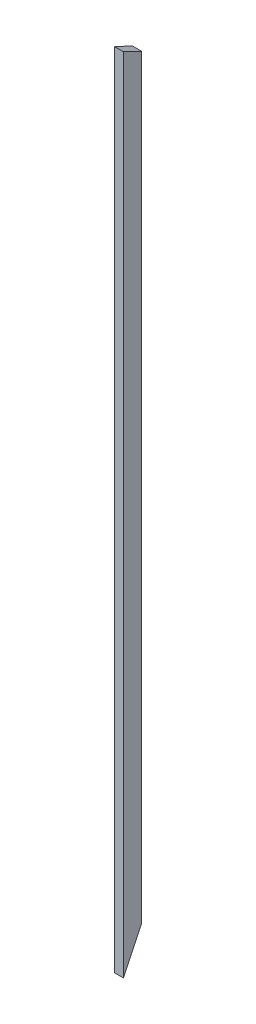
from build123d import *

# Parameters (mm, degrees)
SKETCH_1_W          = 25
SKETCH_1_H          = 50
EXTRUDE_1_DEPTH     = 2214.15898255
CUT_EXTRUDE_2_DEPTH = 50
CUT_EXTRUDE_3_DEPTH = 50


with BuildPart() as part:
    # Эскиз1 → Бобышка-Вытянуть1 (new body)
    with BuildSketch(Plane(origin=(0, 0, 0), x_dir=(1, 0, 0), z_dir=(0, 1, 0))):
        Rectangle(SKETCH_1_W, SKETCH_1_H)
    extrude(amount=EXTRUDE_1_DEPTH)

    # Эскиз3 → Вырез-Вытянуть2 (cut)
    with BuildSketch(Plane.ZY.offset(12.5)):
        Polygon((25, 0), (-25, 105.257973095), (-25, 0), align=None)
    extrude(amount=-CUT_EXTRUDE_2_DEPTH, mode=Mode.SUBTRACT)

    # Эскиз4 → Вырез-Вытянуть3 (cut)
    with BuildSketch(Plane.ZY.offset(12.5)):
        Polygon((25, 2214.15898255), (-25, 2190.418247515), (-25, 2214.15898255), align=None)
    extrude(amount=-CUT_EXTRUDE_3_DEPTH, mode=Mode.SUBTRACT)


solid = part.part
